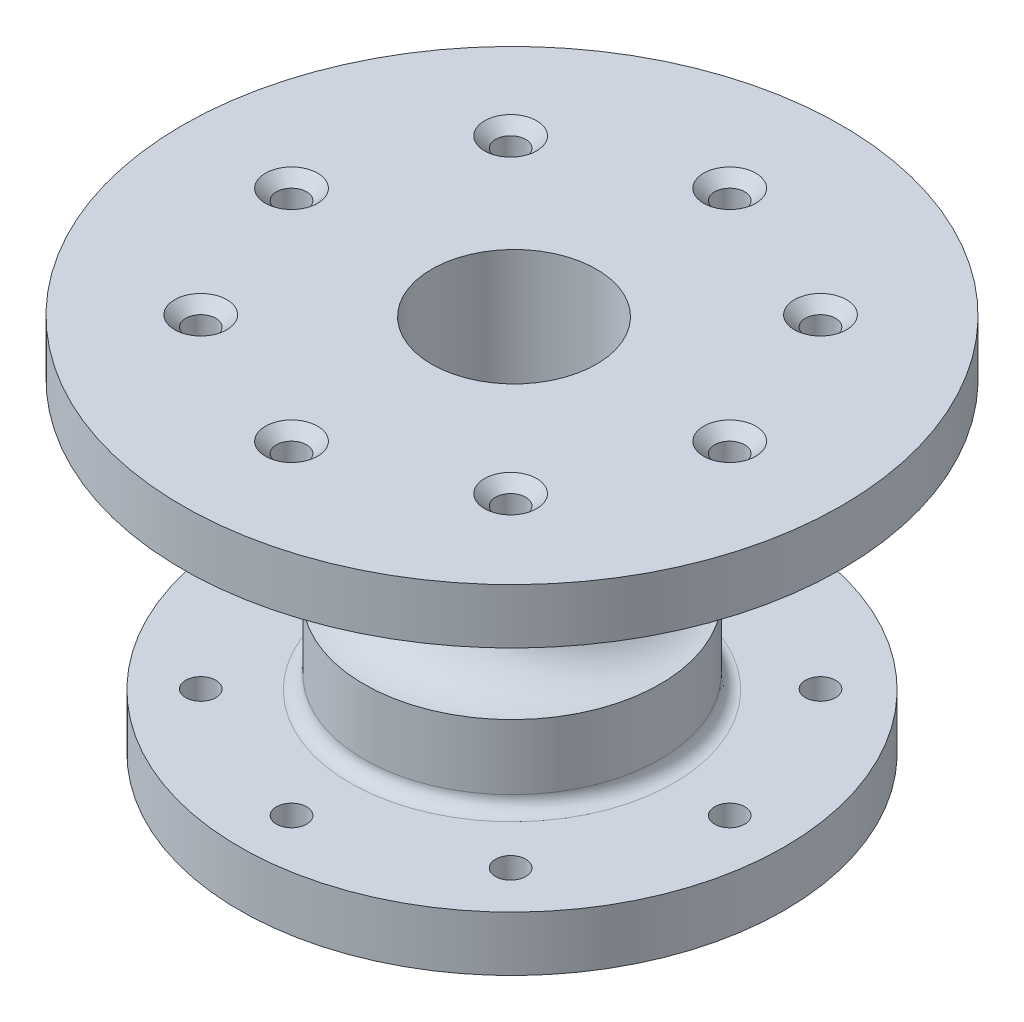
from build123d import *

# Parameters (mm, degrees)
CSK_FOR_M10_CROSS_COUNTERSUNK_HEAD_SCREW_D           = 11
CSK_FOR_M10_CROSS_COUNTERSUNK_HEAD_SCREW_CSINK_D     = 19
CSK_FOR_M10_CROSS_COUNTERSUNK_HEAD_SCREW_CSINK_ANGLE = 92
CIRPATTERN1_COUNT                                    = 8
SKETCH4_R                                            = 30
CUT_EXTRUDE1_DEPTH                                   = 88


with BuildPart() as part:
    # Sketch1 → Revolve1 (revolve)
    with BuildSketch(Plane.XY, mode=Mode.PRIVATE) as revolve1_sk:
        with BuildLine():
            Line((-0.742985442, 69.00355741), (119.257014558, 69.00355741))
            Line((119.257014558, 69.00355741), (119.257014558, 49.00355741))
            Line((119.257014558, 49.00355741), (58.145903447, 49.00355741))
            ThreePointArc((58.145903447, 49.00355741), (54.610369541, 47.539091316), (53.145903447, 44.00355741))
            Line((53.145903447, 44.00355741), (53.145903447, 19.678538808))
            ThreePointArc((53.145903447, 19.678538808), (33.145903447, -0.321461192), (53.145903447, -20.321461192))
            Line((53.145903447, -20.321461192), (53.145903447, -44.00355741))
            ThreePointArc((53.145903447, -44.00355741), (54.610369541, -47.539091316), (58.145903447, -49.00355741))
            Line((58.145903447, -49.00355741), (98.423681225, -49.00355741))
            Line((98.423681225, -49.00355741), (98.423681225, -69.00355741))
            Line((98.423681225, -69.00355741), (-0.742985442, -69.00355741))
            Line((-0.742985442, -69.00355741), (-0.742985442, -7.70421595))
            ThreePointArc((-0.742985442, -7.70421595), (7.739959352, 0), (-0.742985442, 7.70421595))
            Line((-0.742985442, 7.70421595), (-0.742985442, 69.00355741))
        make_face()
    revolve(revolve1_sk.sketch.rotate(Axis((-0.742985442, 69.00355741, 0), (0, -1, 0)), 180), axis=Axis((-0.742985442, 69.00355741, 0), (0, -1, 0)))

    # CSK for M10 Cross Countersunk Head Screw1 (through all)
    with Locations(Plane(origin=(0, 69.00355741, 0), x_dir=(1, 0, 0), z_dir=(0, 1, 0))):
        with Locations((78.534069327, 0)):
            csk_for_m10_cross_countersunk_head_screw = CounterSinkHole(CSK_FOR_M10_CROSS_COUNTERSUNK_HEAD_SCREW_D / 2, CSK_FOR_M10_CROSS_COUNTERSUNK_HEAD_SCREW_CSINK_D / 2, counter_sink_angle=CSK_FOR_M10_CROSS_COUNTERSUNK_HEAD_SCREW_CSINK_ANGLE)

    # CirPattern1: CSK for M10 Cross Countersunk Head Screw1 ×8 about axis
    cirpattern1_axis = Axis((-1.242977, 0, 0), (0, 1, 0))
    for i in range(1, CIRPATTERN1_COUNT):
        add(csk_for_m10_cross_countersunk_head_screw.rotate(cirpattern1_axis, i * 360 / CIRPATTERN1_COUNT), mode=Mode.SUBTRACT)

    # Sketch4 → Cut-Extrude1 (cut)
    with BuildSketch(Plane(origin=(0, 69.00355741, 0), x_dir=(1, 0, 0), z_dir=(0, 1, 0))):
        with Locations(Location((0, 0, 0), (0, 0, 270))):
            Circle(SKETCH4_R)
    extrude(amount=-CUT_EXTRUDE1_DEPTH, mode=Mode.SUBTRACT)


solid = part.part
